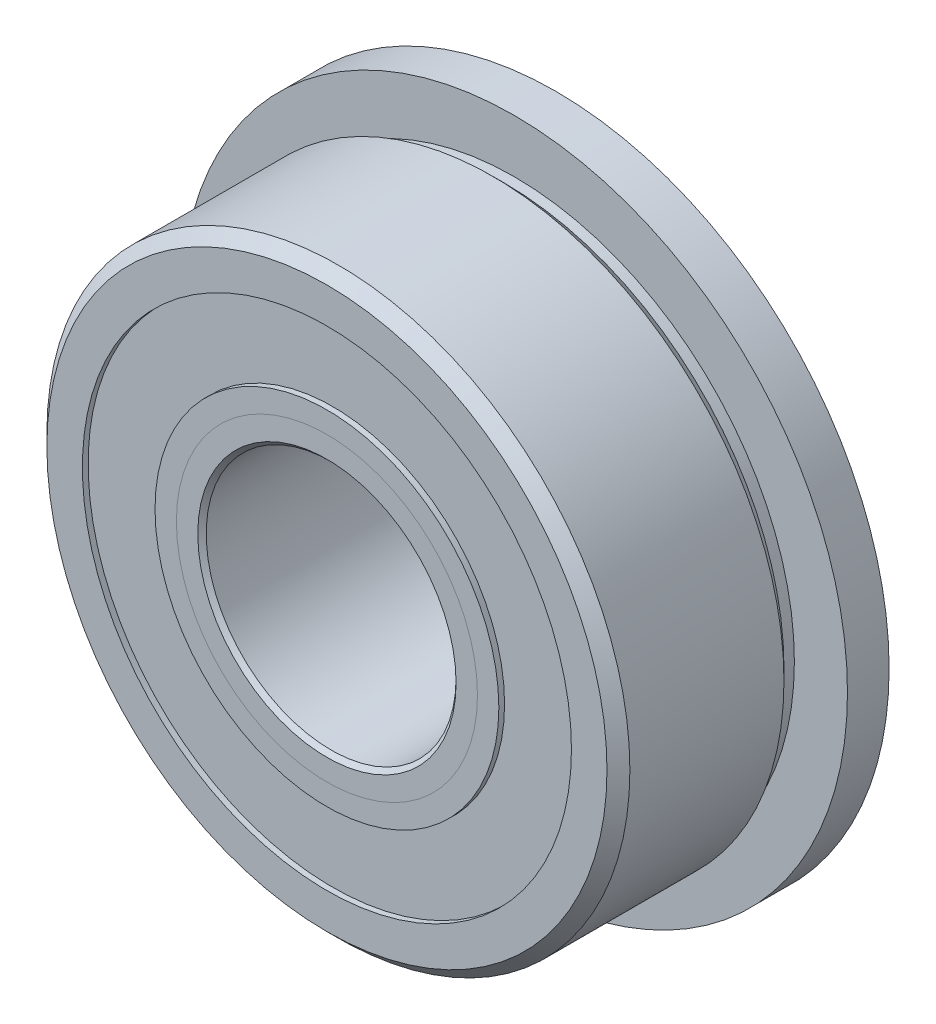
from build123d import *

# Parameters (mm, degrees)
SKETCH5_W          = 1.5875
SKETCH5_H          = 2.701294071
CIRPATTERN1_COUNT  = 12
SKETCH7_W          = 1.294515678
SKETCH7_H          = 2.767948718
SKETCH7_H_2        = 3.365174359
SKETCH9_R          = 5.69680725
SKETCH9_R_2        = 5.45855525
CUT_EXTRUDE1_DEPTH = 0.127
SKETCH10_R         = 6.432804
SKETCH10_R_2       = 5.9563
CUT_EXTRUDE2_DEPTH = 0.254


with BuildPart() as part:
    # Sketch8 → Revolve7 (revolve)
    with BuildSketch(Plane(origin=(0, 0, 0), x_dir=(0, 0, -1), z_dir=(1, 0, 0))):
        with BuildLine():
            Line((4.365625, 10.6759375), (3.9290625, 11.1125))
            Line((3.9290625, 11.1125), (-3.9290625, 11.1125))
            Line((-3.9290625, 11.1125), (-4.365625, 10.6759375))
            Line((-4.365625, 10.6759375), (-4.365625, 9.321474359))
            Line((-4.365625, 9.321474359), (-2.494642857, 9.321474359))
            ThreePointArc((-2.494642857, 9.321474359), (0, 10.790328072), (2.494642857, 9.321474359))
            Line((2.494642857, 9.321474359), (4.365625, 9.321474359))
            Line((4.365625, 9.321474359), (4.365625, 10.6759375))
        make_face()
    revolve(axis=Axis((0, 0, 4.365625), (0, 0, -1)))

    # Sketch5 → Revolve5 (revolve)
    with BuildSketch(Plane(origin=(0, 0, 0), x_dir=(0, 0, -1), z_dir=(1, 0, 0))):
        with Locations((3.571875, 11.349352964)):
            Rectangle(SKETCH5_W, SKETCH5_H)
    revolve(axis=Axis((0, 0, -5.953125), (0, 0, 1)))

    # Sketch6 → Cut-Revolve1 (revolve, cut)
    with BuildSketch(Plane(origin=(0, 0, 0), x_dir=(0, 0, -1), z_dir=(1, 0, 0))):
        Polygon((1.9446875, 11.1125), (2.38125, 10.6759375), (2.778125, 10.6759375), (2.778125, 11.1125), align=None)
    revolve(axis=Axis((0, 0, 4.365625), (0, 0, -1)), mode=Mode.SUBTRACT)


with BuildPart() as body_2:
    # Sketch2 → Revolve2 (revolve)
    with BuildSketch(Plane(origin=(0, 0, 0), x_dir=(0, 0, -1), z_dir=(1, 0, 0))):
        with BuildLine():
            Line((-4.365625, 6.553525641), (-2.494642857, 6.553525641))
            ThreePointArc((-2.494642857, 6.553525641), (-1.447478343, 5.479160223), (0, 5.084671928))
            Line((0, 5.084671928), (0, 4.923585964))
            Line((0, 4.923585964), (-3.550655161, 4.923585964))
            Line((-3.550655161, 4.923585964), (-4.365625, 5.738555802))
            Line((-4.365625, 5.738555802), (-4.365625, 6.553525641))
        make_face()
    revolve(axis=Axis((0, 0, 4.365625), (0, 0, -1)))


with BuildPart() as body_3:
    # Sketch3 → Revolve3 (revolve)
    with BuildSketch(Plane(origin=(0, 0, 0), x_dir=(0, 0, -1), z_dir=(1, 0, 0))):
        with BuildLine():
            Line((-4.365625, 5.738555802), (-3.550655161, 4.923585964))
            Line((-3.550655161, 4.923585964), (0, 4.923585964))
            Line((0, 4.923585964), (0, 5.084671928))
            ThreePointArc((0, 5.084671928), (1.11503476, 5.31160482), (2.052674979, 5.9563))
            Line((2.052674979, 5.9563), (5.953125, 5.9563))
            Line((5.953125, 5.9563), (5.953125, 5.1990625))
            Line((5.953125, 5.1990625), (5.5165625, 4.7625))
            Line((5.5165625, 4.7625), (-4.204539036, 4.7625))
            Line((-4.204539036, 4.7625), (-4.365625, 4.923585964))
            Line((-4.365625, 4.923585964), (-4.365625, 5.738555802))
        make_face()
    revolve(axis=Axis((0, 0, 4.365625), (0, 0, -1)))

    # Sketch9 → Cut-Extrude1 (cut)
    with BuildSketch(Plane(origin=(0, 0, -5.953125), x_dir=(-1, 0, 0), z_dir=(0, 0, -1))):
        Circle(SKETCH9_R)
        Circle(SKETCH9_R_2, mode=Mode.SUBTRACT)
    extrude(amount=-CUT_EXTRUDE1_DEPTH, mode=Mode.SUBTRACT)


with BuildPart() as body_4:
    # Sketch4 → Revolve4 (revolve)
    with BuildSketch(Plane(origin=(0, 0, 0), x_dir=(0, 0, -1), z_dir=(1, 0, 0))):
        with BuildLine():
            Line((-2.852828072, 7.9375), (2.852828072, 7.9375))
            ThreePointArc((2.852828072, 7.9375), (0, 10.790328072), (-2.852828072, 7.9375))
        make_face()
    revolve(axis=Axis((0, 7.9375, 2.852828072), (0, 0, -1)))


with BuildPart() as cirpattern1_1:
    # CirPattern1: pattern copy
    add(body_4.part.rotate(Axis((0, 0, 4.365625), (0, 0, -1)), 1 * 360 / CIRPATTERN1_COUNT))


with BuildPart() as cirpattern1_2:
    # CirPattern1: pattern copy
    add(body_4.part.rotate(Axis((0, 0, 4.365625), (0, 0, -1)), 2 * 360 / CIRPATTERN1_COUNT))


with BuildPart() as cirpattern1_3:
    # CirPattern1: pattern copy
    add(body_4.part.rotate(Axis((0, 0, 4.365625), (0, 0, -1)), 3 * 360 / CIRPATTERN1_COUNT))


with BuildPart() as cirpattern1_4:
    # CirPattern1: pattern copy
    add(body_4.part.rotate(Axis((0, 0, 4.365625), (0, 0, -1)), 4 * 360 / CIRPATTERN1_COUNT))


with BuildPart() as cirpattern1_5:
    # CirPattern1: pattern copy
    add(body_4.part.rotate(Axis((0, 0, 4.365625), (0, 0, -1)), 5 * 360 / CIRPATTERN1_COUNT))


with BuildPart() as cirpattern1_6:
    # CirPattern1: pattern copy
    add(body_4.part.rotate(Axis((0, 0, 4.365625), (0, 0, -1)), 6 * 360 / CIRPATTERN1_COUNT))


with BuildPart() as cirpattern1_7:
    # CirPattern1: pattern copy
    add(body_4.part.rotate(Axis((0, 0, 4.365625), (0, 0, -1)), 7 * 360 / CIRPATTERN1_COUNT))


with BuildPart() as cirpattern1_8:
    # CirPattern1: pattern copy
    add(body_4.part.rotate(Axis((0, 0, 4.365625), (0, 0, -1)), 8 * 360 / CIRPATTERN1_COUNT))


with BuildPart() as cirpattern1_9:
    # CirPattern1: pattern copy
    add(body_4.part.rotate(Axis((0, 0, 4.365625), (0, 0, -1)), 9 * 360 / CIRPATTERN1_COUNT))


with BuildPart() as cirpattern1_10:
    # CirPattern1: pattern copy
    add(body_4.part.rotate(Axis((0, 0, 4.365625), (0, 0, -1)), 10 * 360 / CIRPATTERN1_COUNT))


with BuildPart() as cirpattern1_11:
    # CirPattern1: pattern copy
    add(body_4.part.rotate(Axis((0, 0, 4.365625), (0, 0, -1)), 11 * 360 / CIRPATTERN1_COUNT))


with BuildPart() as body_16:
    # Sketch7 → Revolve6 (revolve)
    with BuildSketch(Plane(origin=(0, 0, 0), x_dir=(0, 0, -1), z_dir=(1, 0, 0))):
        with Locations((-3.500085911, 7.9375)):
            Rectangle(SKETCH7_W, SKETCH7_H)
        with Locations((3.500085911, 7.63888718)):
            Rectangle(SKETCH7_W, SKETCH7_H_2)
    revolve(axis=Axis((0, 0, 4.365625), (0, 0, -1)))

    # Sketch10 → Cut-Extrude2 (cut)
    with BuildSketch(Plane(origin=(0, 0, -4.14734375), x_dir=(-1, 0, 0), z_dir=(0, 0, -1))):
        Circle(SKETCH10_R)
        Circle(SKETCH10_R_2, mode=Mode.SUBTRACT)
    extrude(amount=-CUT_EXTRUDE2_DEPTH, mode=Mode.SUBTRACT)


solid = Compound([part.part, body_2.part, body_3.part, body_4.part, cirpattern1_1.part, cirpattern1_2.part, cirpattern1_3.part, cirpattern1_4.part, cirpattern1_5.part, cirpattern1_6.part, cirpattern1_7.part, cirpattern1_8.part, cirpattern1_9.part, cirpattern1_10.part, cirpattern1_11.part, body_16.part])
